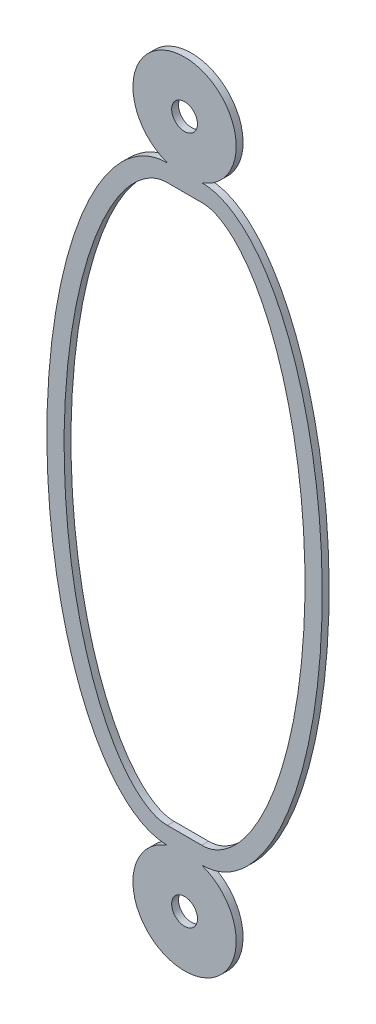
from build123d import *

# Parameters (mm, degrees)
SKETCH1_R           = 0.375
BOSS_EXTRUDE1_DEPTH = 0.1


with BuildPart() as part:
    # Sketch1 → Boss-Extrude1 (new, symmetric)
    with BuildSketch(Plane.XY):
        with BuildLine():
            ThreePointArc((0.5, 8.585786438), (0, 11.5), (-0.5, 8.585786438))
            add(Edge.make_bspline(
                [(-0.5, 8.585786438), (-4, 8.585786438), (-4, 0), (-4, -8.585786438), (-0.5, -8.585786438)],
                knots=[0, 0, 0, 1.570796327, 1.570796327, 3.141592654, 3.141592654, 3.141592654], degree=2, weights=[1, 0.707106781, 1, 0.707106781, 1]))
            ThreePointArc((-0.5, -8.585786438), (0, -11.5), (0.5, -8.585786438))
            add(Edge.make_bspline(
                [(0.5, -8.585786438), (4, -8.585786438), (4, 0), (4, 8.585786438), (0.5, 8.585786438)],
                knots=[3.141592654, 3.141592654, 3.141592654, 4.71238898, 4.71238898, 6.283185307, 6.283185307, 6.283185307], degree=2, weights=[1, 0.707106781, 1, 0.707106781, 1]))
        make_face()
        with Locations((0, 10)):
            Circle(SKETCH1_R, mode=Mode.SUBTRACT)
        with Locations((0, -10)):
            Circle(SKETCH1_R, mode=Mode.SUBTRACT)
        with BuildLine():
            Line((-0.5, 8.085786438), (0.5, 8.085786438))
            add(Edge.make_bspline(
                [(0.5, 8.085786438), (0.659147926, 8.085786438), (0.945909937, 8.018367263), (1.481906813, 7.635759744), (2.024622706, 6.927674691), (2.692554099, 5.589462007), (3.321902915, 3.29131119), (3.589048543, 0), (3.321902915, -3.29131119), (2.692554099, -5.589462007), (2.024622706, -6.927674691), (1.481906813, -7.635759744), (0.945909937, -8.018367263), (0.659147926, -8.085786438), (0.5, -8.085786438)],
                knots=[-3.141592654, -3.141592654, -3.141592654, -3.141592654, -2.945243113, -2.748893572, -2.552544031, -2.35619449, -1.963495408, -1.570796327, -1.178097245, -0.785398163, -0.589048623, -0.392699082, -0.196349541, 0, 0, 0, 0], degree=3))
            Line((0.5, -8.085786438), (-0.5, -8.085786438))
            add(Edge.make_bspline(
                [(-0.5, 8.085786438), (-0.659147926, 8.085786438), (-0.945909937, 8.018367263), (-1.481906813, 7.635759744), (-2.024622706, 6.927674691), (-2.692554099, 5.589462007), (-3.321902915, 3.29131119), (-3.589048543, 0), (-3.321902915, -3.29131119), (-2.692554099, -5.589462007), (-2.024622706, -6.927674691), (-1.481906813, -7.635759744), (-0.945909937, -8.018367263), (-0.659147926, -8.085786438), (-0.5, -8.085786438)],
                knots=[0, 0, 0, 0, 0.196349541, 0.392699082, 0.589048623, 0.785398163, 1.178097245, 1.570796327, 1.963495408, 2.35619449, 2.552544031, 2.748893572, 2.945243113, 3.141592654, 3.141592654, 3.141592654, 3.141592654], degree=3))
        make_face(mode=Mode.SUBTRACT)
    extrude(amount=BOSS_EXTRUDE1_DEPTH, both=True)


solid = part.part
